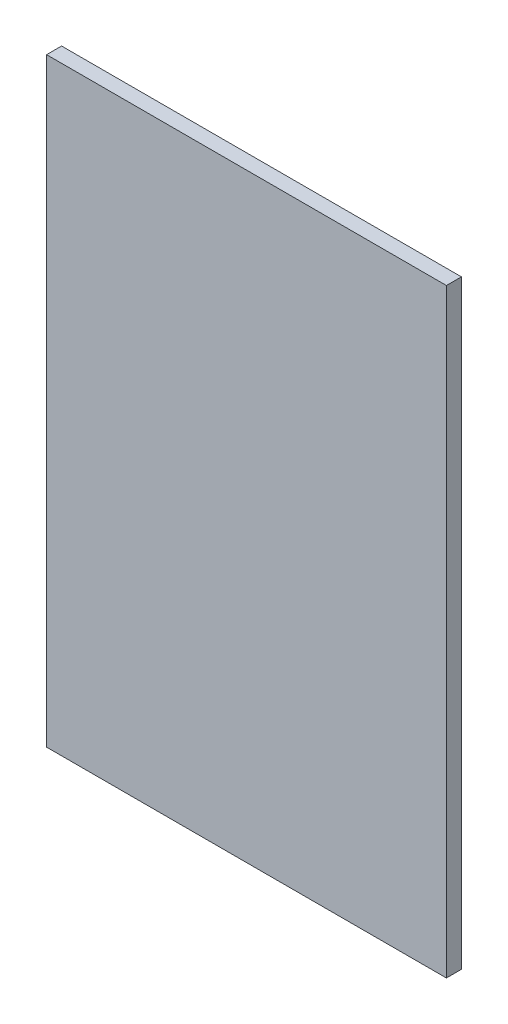
from build123d import *

# Parameters (mm, degrees)
SKIZZE1_W                       = 400
SKIZZE1_H                       = 600
AUFSATZ_LINEAR_AUSTRAGEN1_DEPTH = 15


with BuildPart() as part:
    # Skizze1 → Aufsatz-Linear austragen1 (new body)
    with BuildSketch(Plane.XY):
        Rectangle(SKIZZE1_W, SKIZZE1_H)
    extrude(amount=AUFSATZ_LINEAR_AUSTRAGEN1_DEPTH)


solid = part.part
